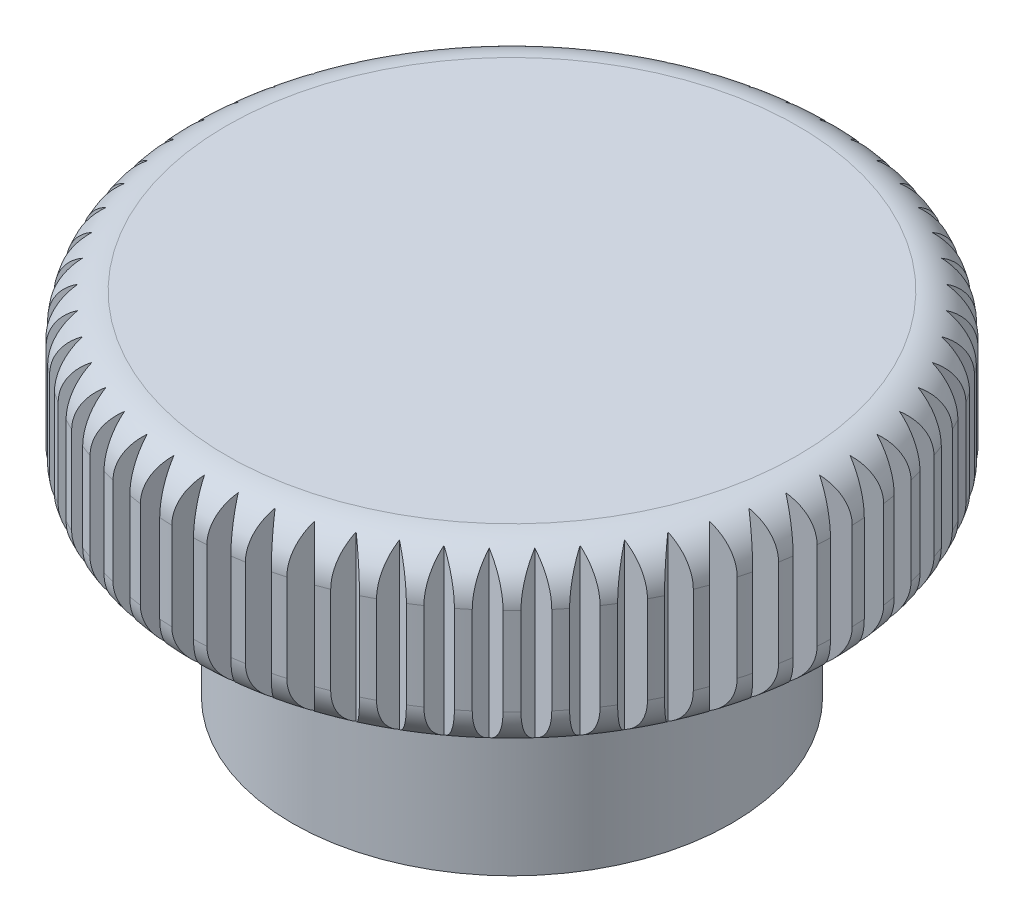
from build123d import *

# Parameters (mm, degrees)
SKETCH_2_R          = 1.9
CUT_EXTRUDE_1_DEPTH = 7
CUT_EXTRUDE_2_DEPTH = 14.285330368


with BuildPart() as part:
    # 草图1 → 旋转1 (revolve)
    with BuildSketch(Plane.XY, mode=Mode.PRIVATE) as revolve_1_sk:
        with BuildLine():
            Line((0, 0), (0, -8))
            Line((0, -8), (5, -8))
            Line((5, -8), (5, -5))
            ThreePointArc((5, -5), (5.292893219, -4.292893219), (6, -4))
            Line((6, -4), (6.5, -4))
            ThreePointArc((6.5, -4), (7.207106781, -3.707106781), (7.5, -3))
            Line((7.5, -3), (7.5, -1))
            ThreePointArc((7.5, -1), (7.207106781, -0.292893219), (6.5, 0))
            Line((6.5, 0), (0, 0))
        make_face()
    revolve(revolve_1_sk.sketch.rotate(Axis((0, 0, 0), (0, -1, 0)), 180), axis=Axis((0, 0, 0), (0, -1, 0)))

    # 草图2 → 切除-拉伸1 (cut)
    with BuildSketch(Plane.XZ.offset(8)):
        Circle(SKETCH_2_R)
    extrude(amount=-CUT_EXTRUDE_1_DEPTH, mode=Mode.SUBTRACT)

    # 草图3 → 切除-拉伸2 (cut, through all)
    with BuildSketch(Plane(origin=(0, 0, 0), x_dir=(1, 0, 0), z_dir=(0, 1, 0))):
        Polygon((0, 7), (0.25, 7.5), (-0.25, 7.5), align=None)
        Polygon((0.731699243, 6.961653268), (1.032593948, 7.432782099), (0.535333001, 7.485046331), align=None)
        Polygon((1.455381836, 6.847033205), (1.803874581, 7.284129083), (1.314800781, 7.388084928), align=None)
        Polygon((2.163118961, 6.657395614), (2.555391587, 7.055669624), (2.079863329, 7.210178121), align=None)
        Polygon((2.847156502, 6.394818203), (3.278911187, 6.749906772), (2.822138459, 6.953275093), align=None)
        Polygon((3.5, 6.062177826), (3.966506351, 6.370190528), (3.533493649, 6.620190528), align=None)
        Polygon((4.114496766, 5.663118961), (4.610643641, 5.920681145), (4.206135144, 6.214573771), align=None)
        Polygon((4.683914245, 5.202013778), (5.204265754, 5.406303539), (4.832693341, 5.740868843), align=None)
        Polygon((5.202013778, 4.683914245), (5.740868843, 4.832693341), (5.406303539, 5.204265754), align=None)
        Polygon((5.663118961, 4.114496766), (6.214573771, 4.206135144), (5.920681145, 4.610643641), align=None)
        Polygon((6.062177826, 3.5), (6.620190528, 3.533493649), (6.370190528, 3.966506351), align=None)
        Polygon((6.394818203, 2.847156502), (6.953275093, 2.822138459), (6.749906772, 3.278911187), align=None)
        Polygon((6.657395614, 2.163118961), (7.210178121, 2.079863329), (7.055669624, 2.555391587), align=None)
        Polygon((6.847033205, 1.455381836), (7.388084928, 1.314800781), (7.284129083, 1.803874581), align=None)
        Polygon((6.961653268, 0.731699243), (7.485046331, 0.535333001), (7.432782099, 1.032593948), align=None)
        Polygon((7, 0), (7.5, -0.25), (7.5, 0.25), align=None)
        Polygon((6.961653268, -0.731699243), (7.432782099, -1.032593948), (7.485046331, -0.535333001), align=None)
        Polygon((6.847033205, -1.455381836), (7.284129083, -1.803874581), (7.388084928, -1.314800781), align=None)
        Polygon((6.657395614, -2.163118961), (7.055669624, -2.555391587), (7.210178121, -2.079863329), align=None)
        Polygon((6.394818203, -2.847156502), (6.749906772, -3.278911187), (6.953275093, -2.822138459), align=None)
        Polygon((6.062177826, -3.5), (6.370190528, -3.966506351), (6.620190528, -3.533493649), align=None)
        Polygon((5.663118961, -4.114496766), (5.920681145, -4.610643641), (6.214573771, -4.206135144), align=None)
        Polygon((5.202013778, -4.683914245), (5.406303539, -5.204265754), (5.740868843, -4.832693341), align=None)
        Polygon((4.683914245, -5.202013778), (4.832693341, -5.740868843), (5.204265754, -5.406303539), align=None)
        Polygon((4.114496766, -5.663118961), (4.206135144, -6.214573771), (4.610643641, -5.920681145), align=None)
        Polygon((3.5, -6.062177826), (3.533493649, -6.620190528), (3.966506351, -6.370190528), align=None)
        Polygon((2.847156502, -6.394818203), (2.822138459, -6.953275093), (3.278911187, -6.749906772), align=None)
        Polygon((2.163118961, -6.657395614), (2.079863329, -7.210178121), (2.555391587, -7.055669624), align=None)
        Polygon((1.455381836, -6.847033205), (1.314800781, -7.388084928), (1.803874581, -7.284129083), align=None)
        Polygon((0.731699243, -6.961653268), (0.535333001, -7.485046331), (1.032593948, -7.432782099), align=None)
        Polygon((0, -7), (-0.25, -7.5), (0.25, -7.5), align=None)
        Polygon((-0.731699243, -6.961653268), (-1.032593948, -7.432782099), (-0.535333001, -7.485046331), align=None)
        Polygon((-1.455381836, -6.847033205), (-1.803874581, -7.284129083), (-1.314800781, -7.388084928), align=None)
        Polygon((-2.163118961, -6.657395614), (-2.555391587, -7.055669624), (-2.079863329, -7.210178121), align=None)
        Polygon((-2.847156502, -6.394818203), (-3.278911187, -6.749906772), (-2.822138459, -6.953275093), align=None)
        Polygon((-3.5, -6.062177826), (-3.966506351, -6.370190528), (-3.533493649, -6.620190528), align=None)
        Polygon((-4.114496766, -5.663118961), (-4.610643641, -5.920681145), (-4.206135144, -6.214573771), align=None)
        Polygon((-4.683914245, -5.202013778), (-5.204265754, -5.406303539), (-4.832693341, -5.740868843), align=None)
        Polygon((-5.202013778, -4.683914245), (-5.740868843, -4.832693341), (-5.406303539, -5.204265754), align=None)
        Polygon((-5.663118961, -4.114496766), (-6.214573771, -4.206135144), (-5.920681145, -4.610643641), align=None)
        Polygon((-6.062177826, -3.5), (-6.620190528, -3.533493649), (-6.370190528, -3.966506351), align=None)
        Polygon((-6.394818203, -2.847156502), (-6.953275093, -2.822138459), (-6.749906772, -3.278911187), align=None)
        Polygon((-6.657395614, -2.163118961), (-7.210178121, -2.079863329), (-7.055669624, -2.555391587), align=None)
        Polygon((-6.847033205, -1.455381836), (-7.388084928, -1.314800781), (-7.284129083, -1.803874581), align=None)
        Polygon((-6.961653268, -0.731699243), (-7.485046331, -0.535333001), (-7.432782099, -1.032593948), align=None)
        Polygon((-7, 0), (-7.5, 0.25), (-7.5, -0.25), align=None)
        Polygon((-6.961653268, 0.731699243), (-7.432782099, 1.032593948), (-7.485046331, 0.535333001), align=None)
        Polygon((-6.847033205, 1.455381836), (-7.284129083, 1.803874581), (-7.388084928, 1.314800781), align=None)
        Polygon((-6.657395614, 2.163118961), (-7.055669624, 2.555391587), (-7.210178121, 2.079863329), align=None)
        Polygon((-6.394818203, 2.847156502), (-6.749906772, 3.278911187), (-6.953275093, 2.822138459), align=None)
        Polygon((-6.062177826, 3.5), (-6.370190528, 3.966506351), (-6.620190528, 3.533493649), align=None)
        Polygon((-5.663118961, 4.114496766), (-5.920681145, 4.610643641), (-6.214573771, 4.206135144), align=None)
        Polygon((-5.202013778, 4.683914245), (-5.406303539, 5.204265754), (-5.740868843, 4.832693341), align=None)
        Polygon((-4.683914245, 5.202013778), (-4.832693341, 5.740868843), (-5.204265754, 5.406303539), align=None)
        Polygon((-4.114496766, 5.663118961), (-4.206135144, 6.214573771), (-4.610643641, 5.920681145), align=None)
        Polygon((-3.5, 6.062177826), (-3.533493649, 6.620190528), (-3.966506351, 6.370190528), align=None)
        Polygon((-2.847156502, 6.394818203), (-2.822138459, 6.953275093), (-3.278911187, 6.749906772), align=None)
        Polygon((-2.163118961, 6.657395614), (-2.079863329, 7.210178121), (-2.555391587, 7.055669624), align=None)
        Polygon((-1.455381836, 6.847033205), (-1.314800781, 7.388084928), (-1.803874581, 7.284129083), align=None)
        Polygon((-0.731699243, 6.961653268), (-0.535333001, 7.485046331), (-1.032593948, 7.432782099), align=None)
    extrude(amount=-CUT_EXTRUDE_2_DEPTH, mode=Mode.SUBTRACT)


solid = part.part
